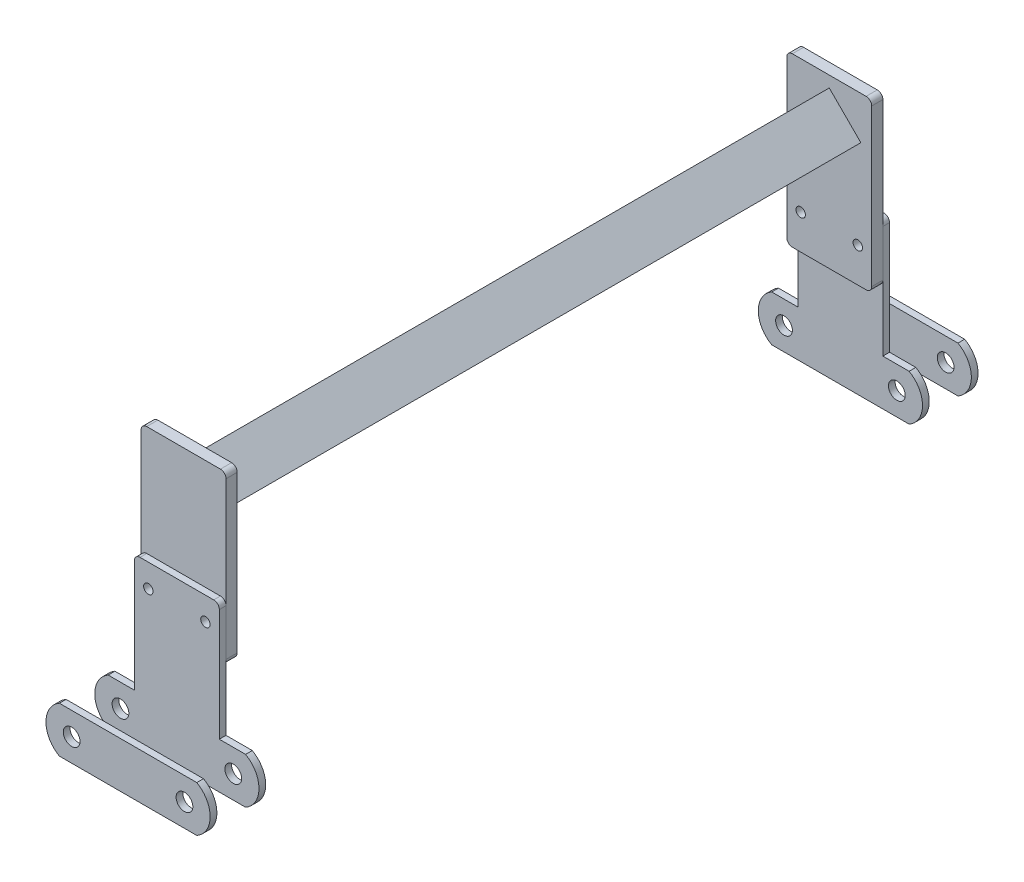
from build123d import *

# Parameters (mm, degrees)
BOSS_EXTRUDE1_START     = 18.85
BOSS_EXTRUDE1_DEPTH     = 6
CUT_EXTRUDE1_DEPTH      = 81.249750778
CUT_EXTRUDE1_DEPTH_BACK = 81.249750778
SKETCH2_R               = 7.5
SKETCH3_W               = 76
SKETCH3_H               = 105.5
BOSS_EXTRUDE2_DEPTH     = 6
FILLET1_R               = 5
SKETCH4_R               = 4.2
CUT_EXTRUDE2_DEPTH      = 153.275868082
SKETCH6_W               = 76
SKETCH6_H               = 150
SKETCH6_R               = 4.2
BOSS_EXTRUDE4_DEPTH     = 10
FILLET2_R               = 5
BOSS_EXTRUDE5_DEPTH     = 588
SKETCH8_R               = 4.2
BOSS_EXTRUDE6_DEPTH     = 10


with BuildPart() as part:
    # Sketch1 → Boss-Extrude1 (new body)
    with BuildSketch(Plane.XY.offset(BOSS_EXTRUDE1_START)):
        with BuildLine():
            Line((-61.5, 20.5), (61.5, 20.5))
            ThreePointArc((61.5, 20.5), (73.5, 0), (61.5, -20.5))
            Line((61.5, -20.5), (-61.5, -20.5))
            ThreePointArc((-61.5, -20.5), (-73.5, 0), (-61.5, 20.5))
        make_face()
    extrude(amount=BOSS_EXTRUDE1_DEPTH)

    # Sketch2 → Cut-Extrude1 (cut, two sides: drawn at the far end of the back side and taken through both)
    with BuildSketch(Plane.XY.offset(-CUT_EXTRUDE1_DEPTH_BACK)):
        with Locations((-50.5, 0)):
            Circle(SKETCH2_R)
        with Locations(Location((50.5, 0, 0), (0, 0, 180))):
            Circle(SKETCH2_R)
    extrude(amount=CUT_EXTRUDE1_DEPTH + CUT_EXTRUDE1_DEPTH_BACK, mode=Mode.SUBTRACT)


with BuildPart() as body_2:
    # Mirror2: mirrored copy
    add(part.part.mirror(Plane.XY))

    # Sketch3 → Boss-Extrude2 (add)
    with BuildSketch(Plane.XY.offset(-18.85)):
        with Locations((0, 73.25)):
            Rectangle(SKETCH3_W, SKETCH3_H)
    extrude(amount=-BOSS_EXTRUDE2_DEPTH)

    # Fillet1
    fillet1_edges = [body_2.edges().sort_by_distance(p)[0] for p in [
        (38, 126, -21.85),
        (-38, 126, -21.85),
    ]]
    fillet(fillet1_edges, radius=FILLET1_R)

    # Sketch4 → Cut-Extrude2 (cut, through all)
    with BuildSketch(Plane.XY.offset(-18.85)):
        with Locations((-25.55, 105.3)):
            Circle(SKETCH4_R)
        with Locations(Location((25.55, 105.3, 0), (0, 0, 180))):
            Circle(SKETCH4_R)
    extrude(amount=-CUT_EXTRUDE2_DEPTH, mode=Mode.SUBTRACT)


with BuildPart() as body_3:
    # Sketch6 → Boss-Extrude4 (new body)
    with BuildSketch(Plane(origin=(0, 0, -24.85), x_dir=(-1, 0, 0), z_dir=(0, 0, -1))):
        with Locations((0, 149.4)):
            Rectangle(SKETCH6_W, SKETCH6_H)
        with Locations((25.55, 105.3)):
            Circle(SKETCH6_R, mode=Mode.SUBTRACT)
        with Locations((-25.55, 105.3)):
            Circle(SKETCH6_R, mode=Mode.SUBTRACT)
    extrude(amount=BOSS_EXTRUDE4_DEPTH)

    # Fillet2
    fillet2_edges = [body_3.edges().sort_by_distance(p)[0] for p in [
        (38, 74.4, -29.85),
        (38, 224.4, -29.85),
        (-38, 224.4, -29.85),
        (-38, 74.4, -29.85),
    ]]
    fillet(fillet2_edges, radius=FILLET2_R)

    # Sketch7 → Boss-Extrude5 (add)
    with BuildSketch(Plane.XY.offset(-24.85)):
        Polygon((0, 214.4), (-28.284271247, 186.115728753), (0, 157.831457505), (28.284271247, 186.115728753), align=None)
    extrude(amount=-BOSS_EXTRUDE5_DEPTH)

    # Sketch8 → Boss-Extrude6 (add)
    with BuildSketch(Plane(origin=(0, 0, -612.85), x_dir=(-1, 0, 0), z_dir=(0, 0, -1))):
        with BuildLine():
            Line((38, 79.4), (38, 219.4))
            ThreePointArc((38, 219.4), (36.535533906, 222.935533906), (33, 224.4))
            Line((33, 224.4), (-33, 224.4))
            ThreePointArc((-33, 224.4), (-36.535533906, 222.935533906), (-38, 219.4))
            Line((-38, 219.4), (-38, 79.4))
            ThreePointArc((-38, 79.4), (-36.535533906, 75.864466094), (-33, 74.4))
            Line((-33, 74.4), (33, 74.4))
            ThreePointArc((33, 74.4), (36.535533906, 75.864466094), (38, 79.4))
        make_face()
        with Locations((25.55, 105.3)):
            Circle(SKETCH8_R, mode=Mode.SUBTRACT)
        with Locations((-25.55, 105.3)):
            Circle(SKETCH8_R, mode=Mode.SUBTRACT)
    extrude(amount=-BOSS_EXTRUDE6_DEPTH)


with BuildPart() as body_4:
    # Mirror3: mirrored copy
    add(body_2.part.mirror(Plane.XY.offset(-318.85)))


with BuildPart() as body_5:
    # Mirror3 2: mirrored copy
    add(part.part.mirror(Plane.XY.offset(-318.85)))


solid = Compound([part.part, body_2.part, body_3.part, body_4.part, body_5.part])
